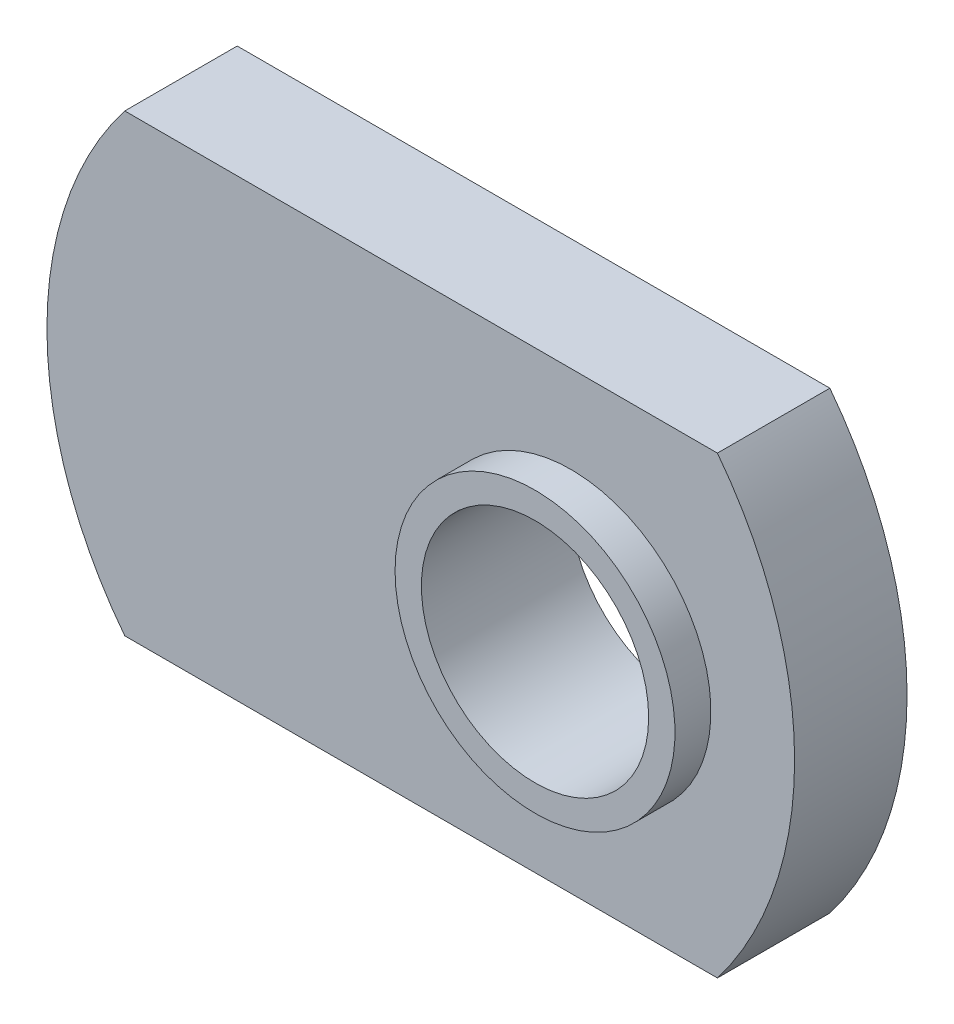
from build123d import *

# Parameters (mm, degrees)
SKETCH1_R      = 2.413
EXTRUDE1_DEPTH = 2.3876
SKETCH2_R      = 2.9718
SKETCH2_R_2    = 2.413
EXTRUDE2_DEPTH = 0.762


with BuildPart() as part:
    # Sketch1 → Extrude1 (new body)
    with BuildSketch(Plane.XY):
        with BuildLine():
            Line((-32.197236546, 20.530230269), (-19.613461217, 20.530230269))
            ThreePointArc((-19.613461217, 20.530230269), (-17.9745326, 15.704230269), (-19.613461217, 10.878230269))
            Line((-19.613461217, 10.878230269), (-32.197236546, 10.878230269))
            ThreePointArc((-32.197236546, 10.878230269), (-33.8495326, 15.704230269), (-32.197236546, 20.530230269))
        make_face()
        with Locations((-22.7243326, 15.704230269)):
            Circle(SKETCH1_R, mode=Mode.SUBTRACT)
    extrude(amount=EXTRUDE1_DEPTH)

    # Sketch2 → Extrude2 (add)
    with BuildSketch(Plane.XY.offset(2.3876)):
        with Locations(Location((-22.7243326, 15.704230269, 0), (0, 0, 180))):
            Circle(SKETCH2_R)
        with Locations((-22.7243326, 15.704230269)):
            Circle(SKETCH2_R_2, mode=Mode.SUBTRACT)
    extrude(amount=EXTRUDE2_DEPTH)


solid = part.part
